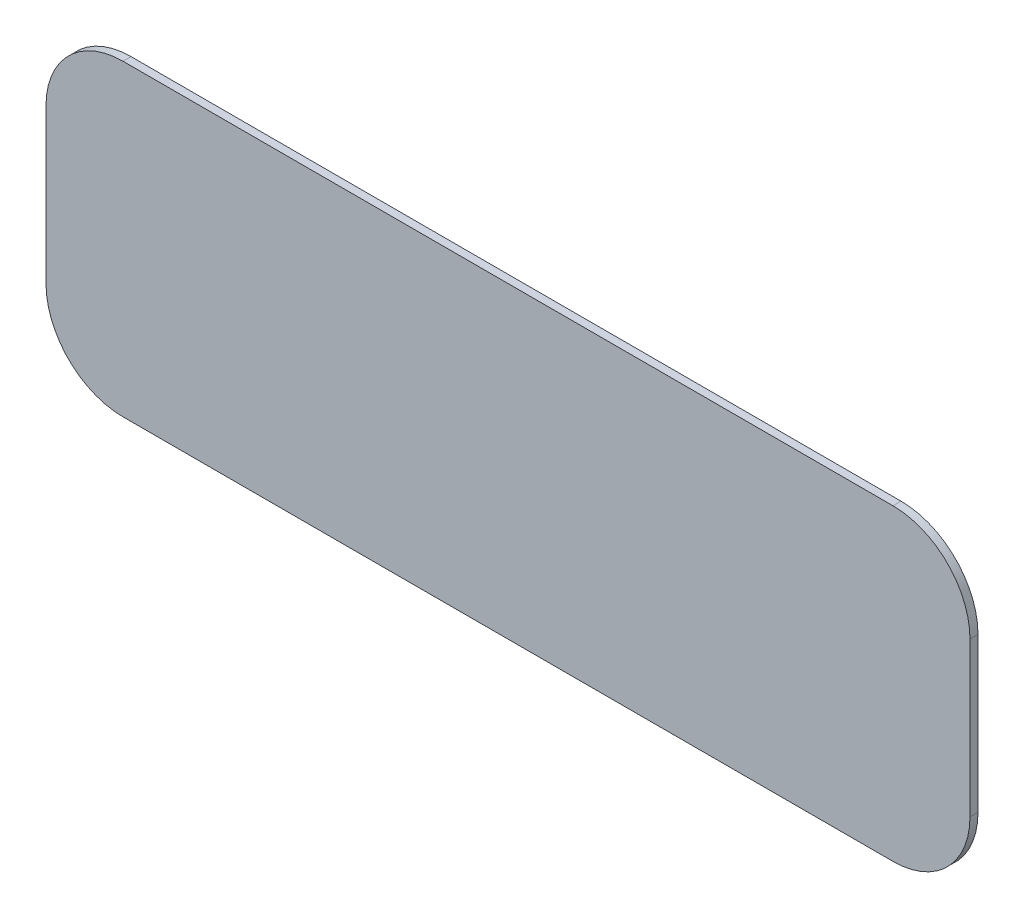
from build123d import *

# Parameters (mm, degrees)
BOSS_EXTRUDE1_DEPTH = 1.5875


with BuildPart() as part:
    # Sketch1 → Boss-Extrude1 (new body)
    with BuildSketch(Plane.XY):
        with BuildLine():
            Line((-76.2, -30.48), (76.2, -30.48))
            ThreePointArc((76.2, -30.48), (86.976307345, -26.016307345), (91.44, -15.24))
            Line((91.44, -15.24), (91.44, 15.24))
            ThreePointArc((91.44, 15.24), (86.976307345, 26.016307345), (76.2, 30.48))
            Line((76.2, 30.48), (-76.2, 30.48))
            ThreePointArc((-76.2, 30.48), (-86.976307345, 26.016307345), (-91.44, 15.24))
            Line((-91.44, 15.24), (-91.44, -15.24))
            ThreePointArc((-91.44, -15.24), (-86.976307345, -26.016307345), (-76.2, -30.48))
        make_face()
    extrude(amount=BOSS_EXTRUDE1_DEPTH)


solid = part.part
